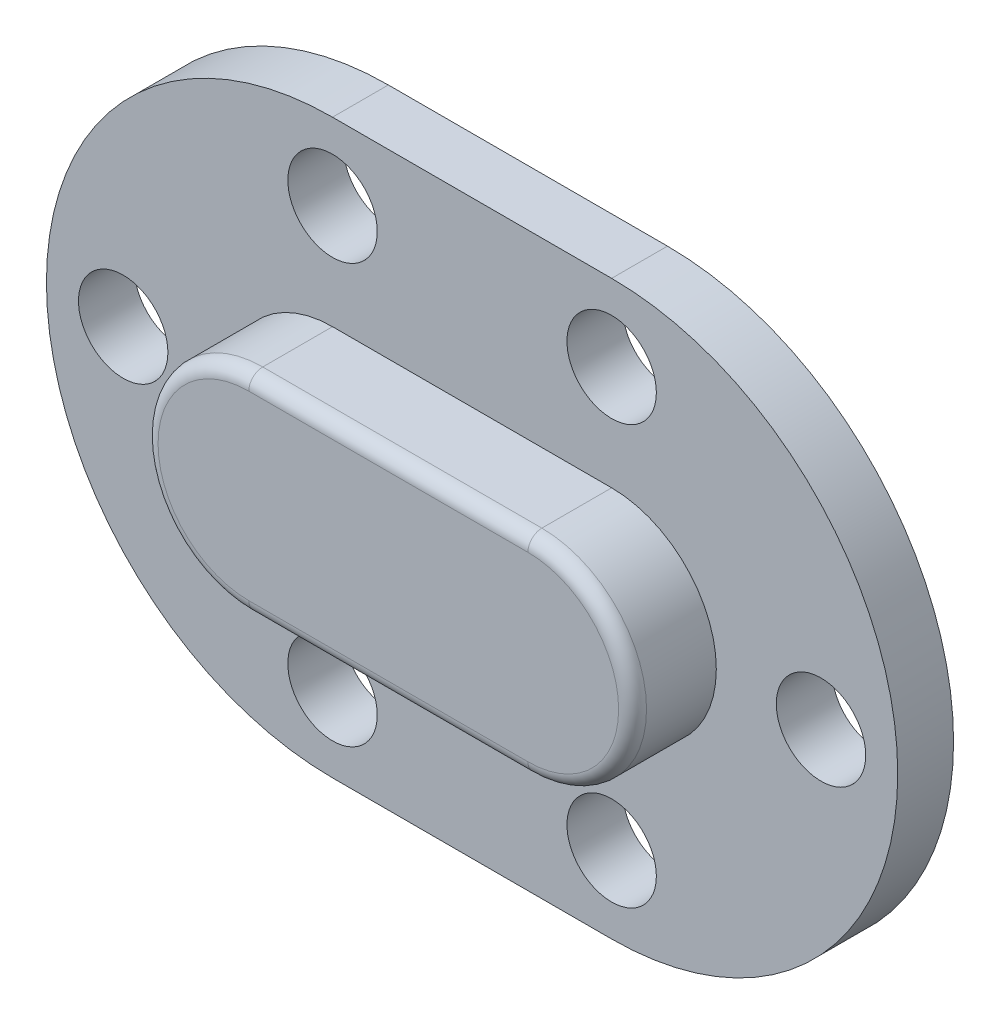
from build123d import *

# Parameters (mm, degrees)
EXTRUDE_1_DEPTH           = 4
EXTRUDE_2_DEPTH           = 6
HOLE_WIZARD_8_0_8_1_D     = 8
HOLE_WIZARD_8_0_8_1_DEPTH = 7
HOLE_WIZARD_8_0_8_1_TIP   = 2.403442476
FILLET_2_R                = 1
SKETCH_10_R               = 3.203547284
CUT_EXTRUDE_1_DEPTH       = 38.235735524
PATTERN_CIRCULAR_1_COUNT  = 3
PATTERN_CIRCULAR_1_ANGLE  = 180
MIRROR_1_COPY_1_SKETCH_R  = 3.203547284
MIRROR_1_COPY_1_DEPTH     = 38.235735524
MIRROR_1_COPY_2_SKETCH_R  = 3.203547284
MIRROR_1_COPY_2_DEPTH     = 38.235735524


with BuildPart() as part:
    # 草图1 → 凸台-拉伸1 (new body)
    with BuildSketch(Plane.XY):
        with BuildLine():
            Line((-10, 20.5), (10, 20.5))
            ThreePointArc((10, 20.5), (30.5, 0), (10, -20.5))
            Line((10, -20.5), (-10, -20.5))
            ThreePointArc((-10, -20.5), (-30.5, 0), (-10, 20.5))
        make_face()
    extrude(amount=EXTRUDE_1_DEPTH)

    # 草图2 → 凸台-拉伸2 (add)
    with BuildSketch(Plane.XY.offset(4)):
        with BuildLine():
            Line((-10, 7.5), (10, 7.5))
            ThreePointArc((10, 7.5), (17.5, 0), (10, -7.5))
            Line((10, -7.5), (-10, -7.5))
            ThreePointArc((-10, -7.5), (-17.5, 0), (-10, 7.5))
        make_face()
    extrude(amount=EXTRUDE_2_DEPTH)

    # Ø8.0 (8) 直径孔1
    with Locations(Plane(origin=(0, 0, 0), x_dir=(-1, 0, 0), z_dir=(0, 0, -1))):
        with Locations((-10, 0), (10, 0)):
            Hole(HOLE_WIZARD_8_0_8_1_D / 2, depth=HOLE_WIZARD_8_0_8_1_DEPTH)
            with Locations((0, 0, -(HOLE_WIZARD_8_0_8_1_DEPTH + HOLE_WIZARD_8_0_8_1_TIP / 2))):  # 118° drill point
                Cone(0, HOLE_WIZARD_8_0_8_1_D / 2, HOLE_WIZARD_8_0_8_1_TIP, mode=Mode.SUBTRACT)

    # 圆角2
    fillet_2_edges = [part.edges().sort_by_distance(p)[0] for p in [
        (-17.5, 0, 10),
        (0, -7.5, 10),
        (17.5, 0, 10),
        (0, 7.5, 10),
    ]]
    fillet(fillet_2_edges, radius=FILLET_2_R)

    # 草图10 → 切除-拉伸1 (cut, symmetric)
    with BuildSketch(Plane.XY.offset(4)):
        with Locations((-10, 15)):
            Circle(SKETCH_10_R)
    cut_extrude_1 = extrude(amount=CUT_EXTRUDE_1_DEPTH, both=True, mode=Mode.SUBTRACT)

    # 阵列(圆周)1: 切除-拉伸1 ×3 about axis
    pattern_circular_1_axis = Axis((-10, 0, 0), (0, 0, 1))
    for i in range(1, PATTERN_CIRCULAR_1_COUNT):
        add(cut_extrude_1.rotate(pattern_circular_1_axis, i * PATTERN_CIRCULAR_1_ANGLE / (PATTERN_CIRCULAR_1_COUNT - 1)), mode=Mode.SUBTRACT)

    # 镜向1: 切除-拉伸1 across plane
    add(cut_extrude_1.mirror(Plane(origin=(0, 0, 0), x_dir=(0, 0, 1), z_dir=(1, 0, 0))), mode=Mode.SUBTRACT)

    # 镜向1 copy 1 sketch → 镜向1 copy 1 (cut, symmetric)
    with BuildSketch(Plane(origin=(10, 10, 4), x_dir=(0, 1, 0), z_dir=(0, 0, 1))):
        with Locations((-10, -15)):
            Circle(MIRROR_1_COPY_1_SKETCH_R)
    extrude(amount=MIRROR_1_COPY_1_DEPTH, both=True, mode=Mode.SUBTRACT)

    # 镜向1 copy 2 sketch → 镜向1 copy 2 (cut, symmetric)
    with BuildSketch(Plane(origin=(20, 0, 4), x_dir=(1, 0, 0), z_dir=(0, 0, 1))):
        with Locations((-10, -15)):
            Circle(MIRROR_1_COPY_2_SKETCH_R)
    extrude(amount=MIRROR_1_COPY_2_DEPTH, both=True, mode=Mode.SUBTRACT)


solid = part.part
